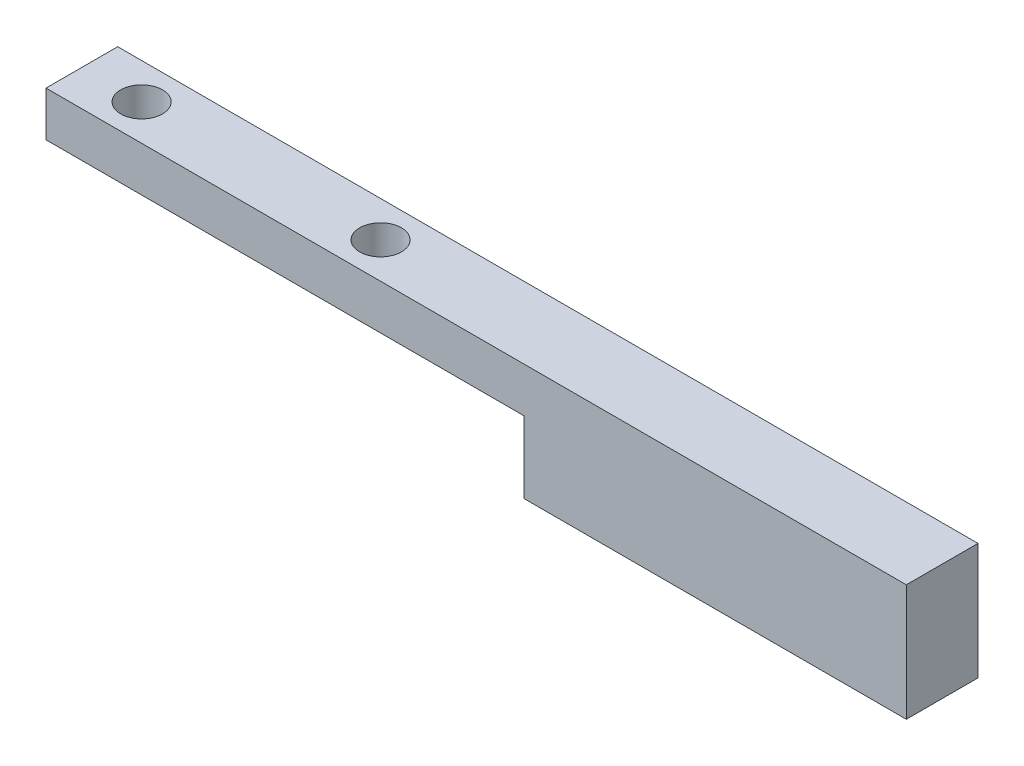
from build123d import *

# Parameters (mm, degrees)
SKETCH_1_W      = 40
SKETCH_1_H      = 6
SKETCH_1_R      = 1.75
EXTRUDE_1_DEPTH = 3.75
SKETCH_2_W      = 6
SKETCH_2_H      = 9.75
EXTRUDE_2_DEPTH = 32


with BuildPart() as part:
    # 草图1 → 凸台-拉伸1 (new body)
    with BuildSketch(Plane(origin=(0, 0, 0), x_dir=(1, 0, 0), z_dir=(0, 1, 0))):
        Rectangle(SKETCH_1_W, SKETCH_1_H)
        with Locations(Location((-15, 0, 0), (0, 0, 270))):
            Circle(SKETCH_1_R, mode=Mode.SUBTRACT)
        with Locations(Location((5, 0, 0), (0, 0, 270))):
            Circle(SKETCH_1_R, mode=Mode.SUBTRACT)
    extrude(amount=EXTRUDE_1_DEPTH)

    # 草图2 → 凸台-拉伸2 (add)
    with BuildSketch(Plane(origin=(20, 0, 0), x_dir=(0, 0, -1), z_dir=(1, 0, 0))):
        with Locations((0, -1.125)):
            Rectangle(SKETCH_2_W, SKETCH_2_H)
    extrude(amount=EXTRUDE_2_DEPTH)


solid = part.part
